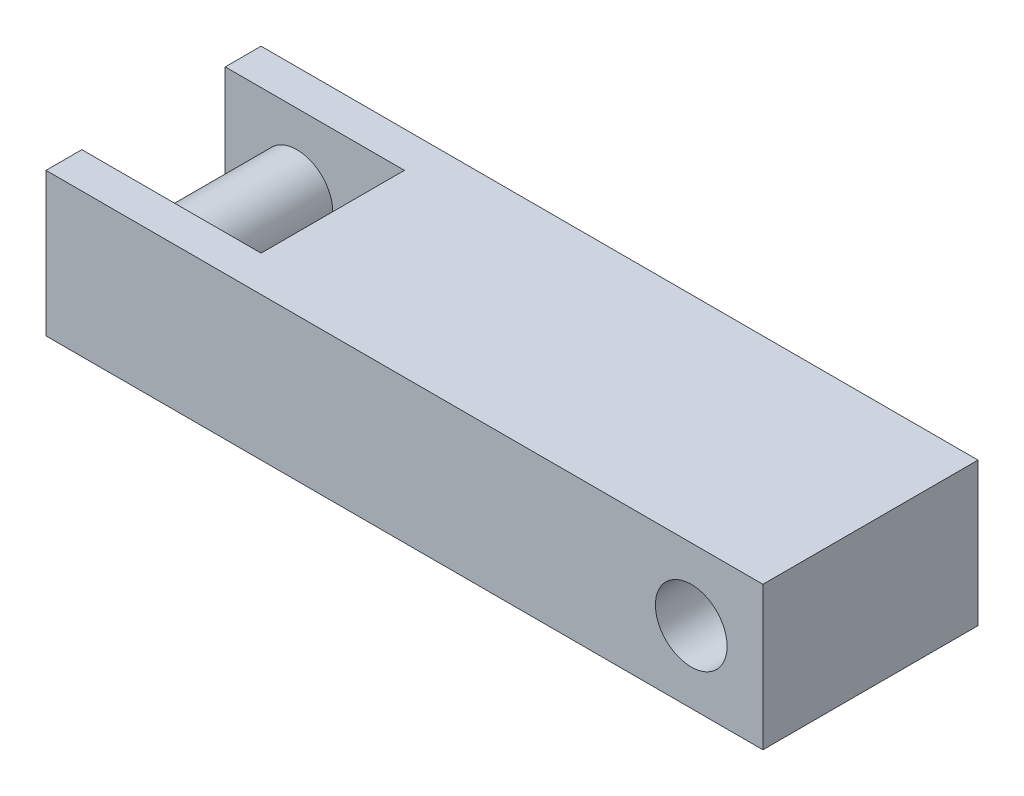
from build123d import *

# Parameters (mm, degrees)
SKETCH1_W           = 100
SKETCH1_H           = 20
SKETCH1_R           = 5
BOSS_EXTRUDE1_DEPTH = 30
SKETCH4_W           = 20
SKETCH4_H           = 20
CUT_EXTRUDE1_DEPTH  = 25
BOSS_EXTRUDE2_REACH = 108.301
SKETCH5_R           = 5


with BuildPart() as part:
    # Sketch1 → Boss-Extrude1 (new body)
    with BuildSketch(Plane.XY):
        with Locations((50, 10)):
            Rectangle(SKETCH1_W, SKETCH1_H)
        with Locations((90, 10)):
            Circle(SKETCH1_R, mode=Mode.SUBTRACT)
    extrude(amount=BOSS_EXTRUDE1_DEPTH)

    # Sketch4 → Cut-Extrude1 (cut)
    with BuildSketch(Plane.ZY):
        with Locations((15, 10)):
            Rectangle(SKETCH4_W, SKETCH4_H)
    extrude(amount=-CUT_EXTRUDE1_DEPTH, mode=Mode.SUBTRACT)

    # Sketch5 → Boss-Extrude2 (add, up to next)
    with BuildSketch(Plane.XY.offset(30), mode=Mode.PRIVATE) as boss_extrude2_sk1:
        with Locations(Location((10, 10, 0), (0, 0, 270))):
            Circle(SKETCH5_R)
    boss_extrude2_tool1 = extrude(boss_extrude2_sk1.sketch, amount=-BOSS_EXTRUDE2_REACH, mode=Mode.PRIVATE) - part.part
    add(boss_extrude2_tool1.solids().sort_by_distance((10, 10, 30))[0])


solid = part.part
